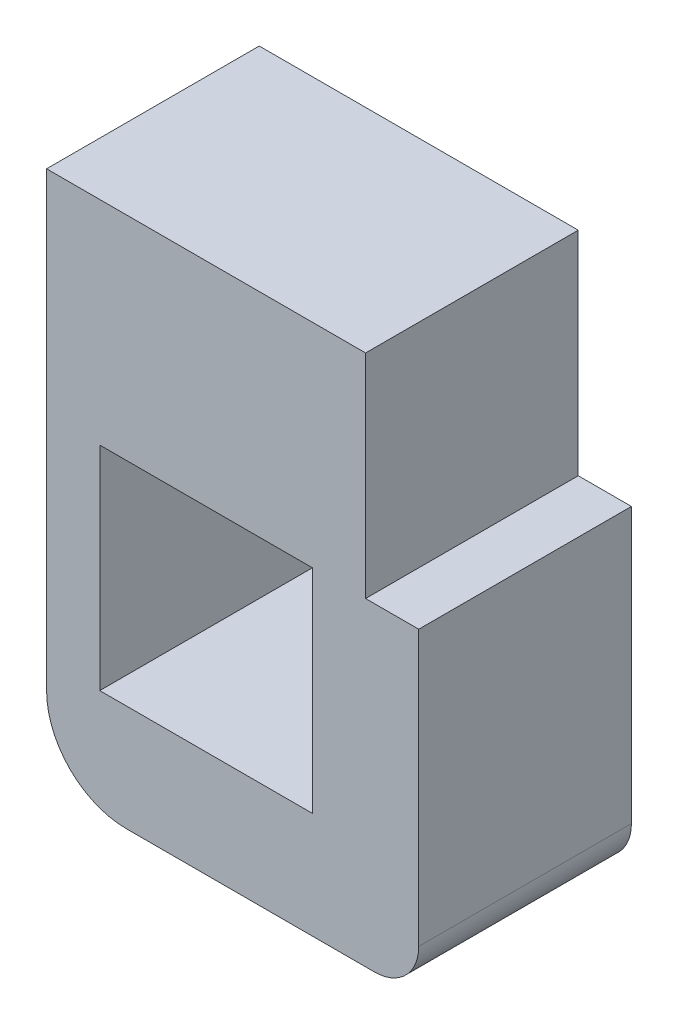
from build123d import *

# Parameters (mm, degrees)
ESQUISSE1_W             = 4
ESQUISSE1_H             = 4
BOSS_EXTRU_1_DEPTH      = 4
ENL_V_MAT_EXTRU_1_REACH = 14.845
CONG_2_R                = 1.5


with BuildPart() as part:
    # Esquisse1 → Boss.-Extru.1 (new body)
    with BuildSketch(Plane.XY):
        with BuildLine():
            Line((0, 0), (6, 0))
            Line((6, 0), (6, -4))
            Line((6, -4), (7, -4))
            Line((7, -4), (7, -9.166666667))
            ThreePointArc((7, -9.166666667), (6.755922318, -9.755922318), (6.166666667, -10))
            Line((6.166666667, -10), (-0.166666667, -10))
            ThreePointArc((-0.166666667, -10), (-0.755922318, -9.755922318), (-1, -9.166666667))
            Line((-1, -9.166666667), (-1, -4))
            Line((-1, -4), (0, -4))
            Line((0, -4), (0, 0))
        make_face()
        with Locations((3, -6)):
            Rectangle(ESQUISSE1_W, ESQUISSE1_H, mode=Mode.SUBTRACT)
    extrude(amount=BOSS_EXTRU_1_DEPTH)

    # Esquisse2 → Enlèv. mat.-Extru.1 (cut, up to next)
    with BuildSketch(Plane.XY.offset(4), mode=Mode.PRIVATE) as enl_v_mat_extru_1_sk1:
        Polygon((0, 0), (0, -10.686908442), (-3.147637421, -9.875475315), (-3.03761259, -0.798426774), align=None)
    enl_v_mat_extru_1_tool1 = extrude(enl_v_mat_extru_1_sk1.sketch, amount=-ENL_V_MAT_EXTRU_1_REACH, mode=Mode.PRIVATE) & part.part
    add(enl_v_mat_extru_1_tool1.solids().sort_by_distance((-1.504511, -5.371974, 4))[0], mode=Mode.SUBTRACT)

    # Congé2
    cong_2_edges = [part.edges().sort_by_distance(p)[0] for p in [
        (0, -10, 2),
    ]]
    fillet(cong_2_edges, radius=CONG_2_R)


solid = part.part
